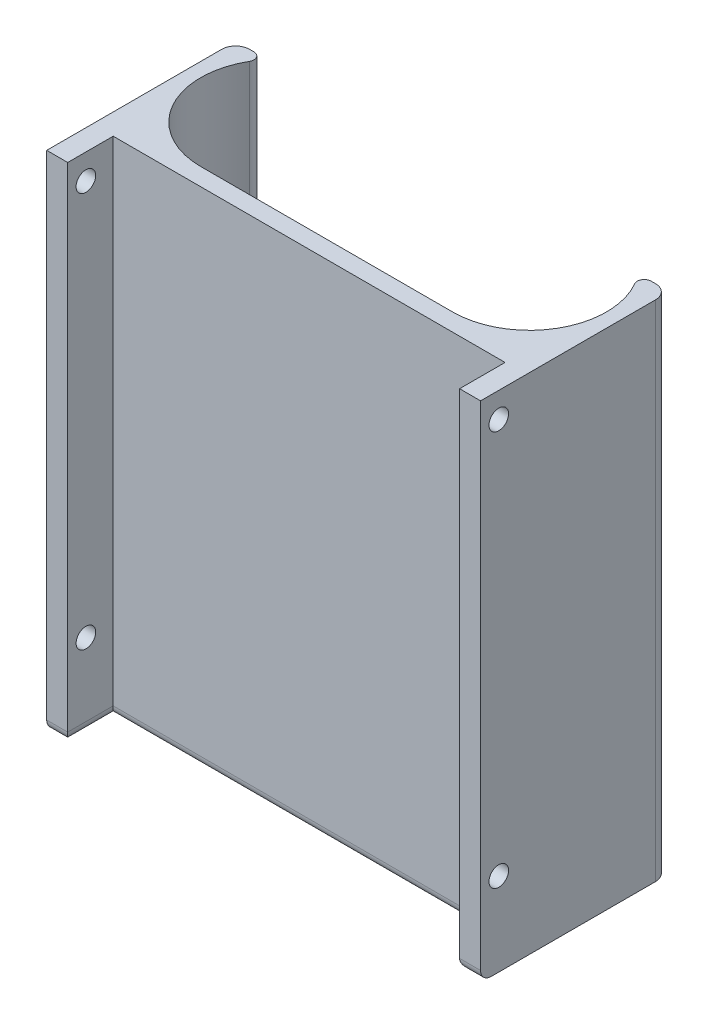
from build123d import *

# Parameters (mm, degrees)
BOSS_EXTRUDE1_DEPTH = 72
CUT_EXTRUDE1_DEPTH  = 65
FILLET3_R           = 2
FILLET4_R           = 1.5
SKETCH5_R           = 1.4
CUT_EXTRUDE2_DEPTH  = 96.970047411
SKETCH6_W           = 24
SKETCH6_H           = 8
BOSS_EXTRUDE3_DEPTH = 7
FILLET5_R           = 2
SKETCH7_R           = 1.6
CUT_EXTRUDE3_DEPTH  = 7
FILLET6_R           = 1


with BuildPart() as part:
    # Sketch1 → Boss-Extrude1 (new body)
    with BuildSketch(Plane(origin=(0, 0, 0), x_dir=(1, 0, 0), z_dir=(0, 1, 0))):
        Polygon((-31, 13.5), (-31, -13.5), (-28, -13.5), (-28, -7), (28, -7), (28, -13.5), (31, -13.5), (31, 13.5), (28, 13.5), (-28, 13.5), align=None)
    extrude(amount=BOSS_EXTRUDE1_DEPTH)

    # Sketch2 → Cut-Extrude1 (cut)
    with BuildSketch(Plane(origin=(0, 72, 0), x_dir=(1, 0, 0), z_dir=(0, 1, 0))):
        with BuildLine():
            Line((17.999983181, 17.5), (-18.000016819, 17.500086496))
            ThreePointArc((-18.000016819, 17.500086496), (-29.000086496, 6.499978376), (-17.999973571, -4.500086496))
            Line((-17.999973571, -4.500086496), (18.000026429, -4.5))
            ThreePointArc((18.000026429, -4.5), (29, 6.500021624), (17.999983181, 17.5))
        make_face()
    extrude(amount=-CUT_EXTRUDE1_DEPTH, mode=Mode.SUBTRACT)

    # Fillet3
    fillet3_edges = [part.edges().sort_by_distance(p)[0] for p in [
        (31, 36, -13.5),
        (-31, 36, -13.5),
    ]]
    fillet(fillet3_edges, radius=FILLET3_R)

    # Fillet4
    fillet4_edges = [part.edges().sort_by_distance(p)[0] for p in [
        (29.5, 0, 13.5),
        (28, 0, 10.25),
        (0, 0, 7),
        (-28, 0, 10.25),
        (-29.5, 0, 13.5),
    ]]
    fillet(fillet4_edges, radius=FILLET4_R)

    # Sketch5 → Cut-Extrude2 (cut, through all)
    with BuildSketch(Plane.ZY.offset(31)):
        with Locations((10.9, 68.4)):
            Circle(SKETCH5_R)
        with Locations((10.9, 11.9)):
            Circle(SKETCH5_R)
    extrude(amount=-CUT_EXTRUDE2_DEPTH, mode=Mode.SUBTRACT)

    # Sketch6 → Boss-Extrude3 (add)
    with BuildSketch(Plane(origin=(0, 0, 0), x_dir=(1, 0, 0), z_dir=(0, 1, 0))):
        with Locations((-5.6065e-05, 17.5)):
            Rectangle(SKETCH6_W, SKETCH6_H)
    extrude(amount=BOSS_EXTRUDE3_DEPTH)

    # Fillet5
    fillet5_edges = [part.edges().sort_by_distance(p)[0] for p in [
        (-12.000056065, 3.5, -21.5),
        (-12.000056065, 3.5, -13.5),
        (11.999943935, 3.5, -13.5),
        (11.999943935, 3.5, -21.5),
    ]]
    fillet(fillet5_edges, radius=FILLET5_R)

    # Sketch7 → Cut-Extrude3 (cut)
    with BuildSketch(Plane(origin=(0, 7, 0), x_dir=(1, 0, 0), z_dir=(0, 1, 0))):
        with Locations(Location((-8.000056065, 17.5, 0), (0, 0, 270))):
            Circle(SKETCH7_R)
        with Locations(Location((7.999943935, 17.5, 0), (0, 0, 270))):
            Circle(SKETCH7_R)
    extrude(amount=-CUT_EXTRUDE3_DEPTH, mode=Mode.SUBTRACT)

    # Fillet6
    fillet6_edges = [part.edges().sort_by_distance(p)[0] for p in [
        (26.485281374, 39.5, -13.5),
        (-26.485393504, 39.5, -13.5),
    ]]
    fillet(fillet6_edges, radius=FILLET6_R)


solid = part.part
